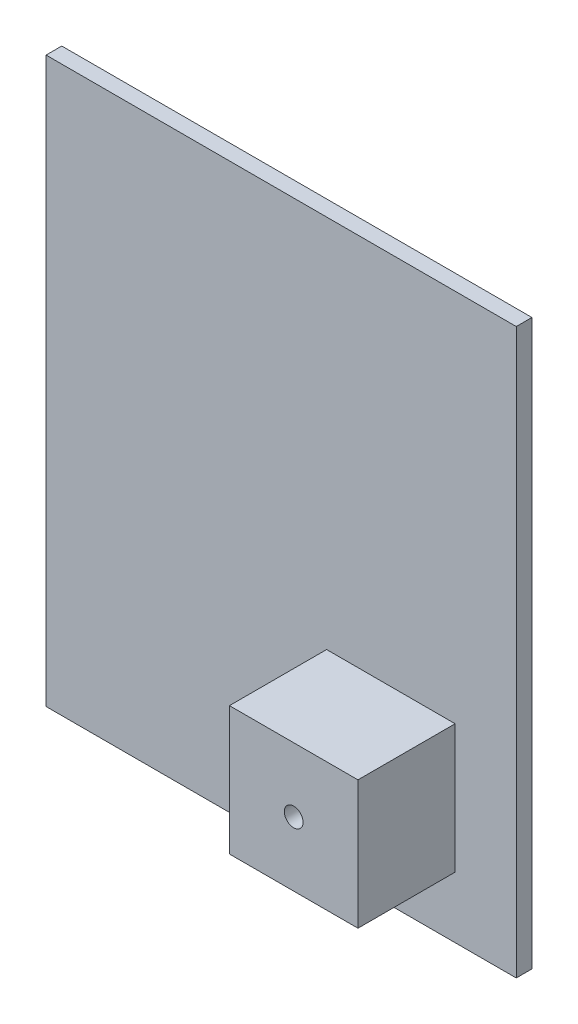
from build123d import *

# Parameters (mm, degrees)
SKETCH1_W           = 150
SKETCH1_H           = 180
SKETCH1_W_2         = 41
SKETCH1_H_2         = 41
BOSS_EXTRUDE1_DEPTH = 5
SKETCH1_3_W         = 41
SKETCH1_3_H         = 41
SKETCH1_3_R         = 3
BOSS_EXTRUDE2_DEPTH = 36
SKETCH1_5_R         = 3
BOSS_EXTRUDE3_DEPTH = 20


with BuildPart() as part:
    # Sketch1 → Boss-Extrude1 (new body)
    with BuildSketch(Plane.XY):
        Rectangle(SKETCH1_W, SKETCH1_H)
        with Locations((35, -50)):
            Rectangle(SKETCH1_W_2, SKETCH1_H_2, mode=Mode.SUBTRACT)
    extrude(amount=BOSS_EXTRUDE1_DEPTH)

    # Sketch1<3> → Boss-Extrude2 (add)
    with BuildSketch(Plane.XY):
        with Locations((35, -50)):
            Rectangle(SKETCH1_3_W, SKETCH1_3_H)
        with Locations((35, -50)):
            Circle(SKETCH1_3_R, mode=Mode.SUBTRACT)
    extrude(amount=BOSS_EXTRUDE2_DEPTH)


with BuildPart() as body_2:
    # Sketch1<5> → Boss-Extrude3 (new body)
    with BuildSketch(Plane.XY):
        with Locations((35, -50)):
            Circle(SKETCH1_5_R)
    extrude(amount=-BOSS_EXTRUDE3_DEPTH)


solid = Compound([part.part, body_2.part])
